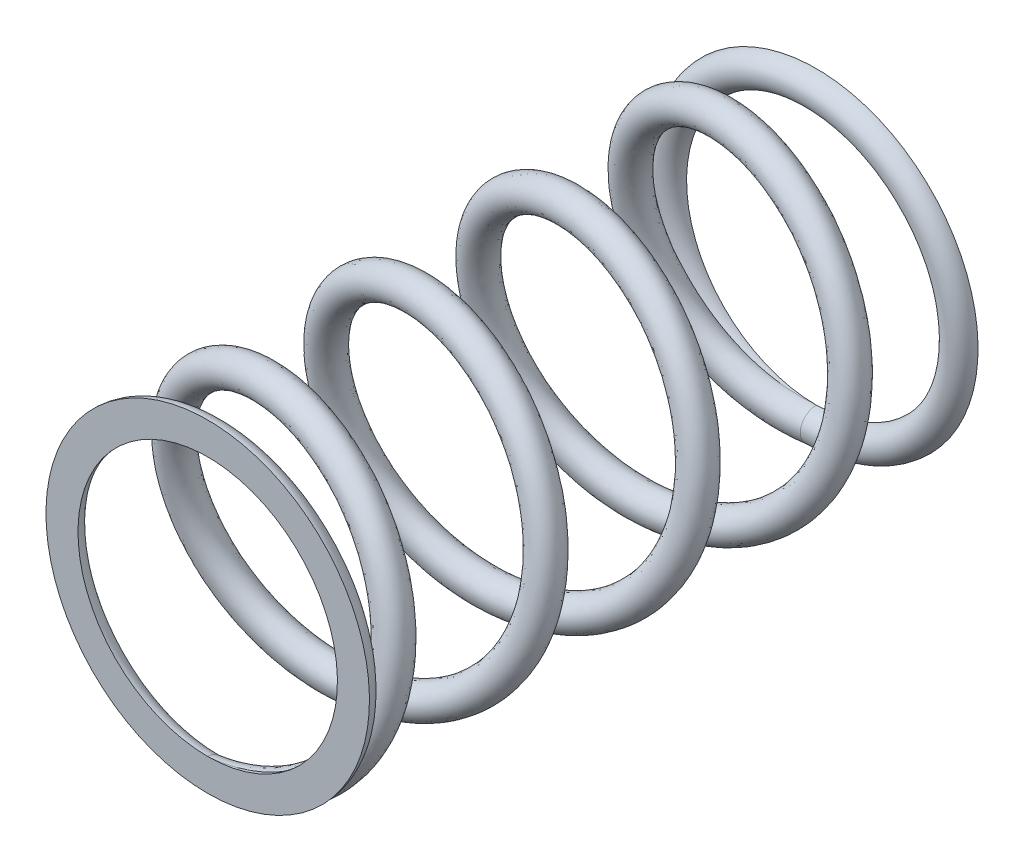
from build123d import *
from build123d.topology import SkipClean

# Parameters (mm, degrees)
SWEEP1_PITCH                  = 4.75
SWEEP1_HEIGHT                 = 19
SWEEP1_RADIUS                 = 4.55
SWEEP1_START_ANGLE            = -90
SCHIZZO19_R                   = 0.5
SCHIZZO17_R                   = 0.5
SCHIZZO18_R                   = 0.5
TAGLIO_ESTRUSIONE1_DEPTH      = 21.766680185
TAGLIO_ESTRUSIONE1_DEPTH_BACK = 21.766680185
SCHIZZO23_W                   = 10.1
SCHIZZO23_H                   = 0.5


with BuildPart() as part:
    # Sweep1: sweep along a helix
    with BuildLine() as sweep1_path:
        add(Helix(SWEEP1_PITCH, SWEEP1_HEIGHT, SWEEP1_RADIUS, center=(0, 0, 0), direction=(0, 0, 1), lefthand=True, mode=Mode.PRIVATE).rotate(Axis((0, 0, 0), (0, 0, 1)), SWEEP1_START_ANGLE))
    # Schizzo19 → Sweep1 (sweep)
    with BuildSketch(Plane(origin=(0, 0, 0), x_dir=(0, 0, -1), z_dir=(1, 0, 0))):
        with Locations((0, -4.55)):
            Circle(SCHIZZO19_R)
    sweep(path=sweep1_path.line, is_frenet=True)

    # Schizzo17 → Rivoluzione3 (revolve)
    with SkipClean():  # the faces are left unmerged after this step: merging them gives an invalid solid
        with BuildSketch(Plane.ZY, mode=Mode.PRIVATE) as rivoluzione3_sk:
            with Locations((19, -4.55)):
                Circle(SCHIZZO17_R)
        revolve(rivoluzione3_sk.sketch.rotate(Axis((0, 0, -1000), (0, 0, 1)), 270), axis=Axis((0, 0, -1000), (0, 0, 1)))

    # Schizzo18 → Rivoluzione4 (revolve)
    with SkipClean():  # the faces are left unmerged after this step: merging them gives an invalid solid
        with BuildSketch(Plane(origin=(0, 0, 0), x_dir=(0, 0, -1), z_dir=(1, 0, 0)), mode=Mode.PRIVATE) as rivoluzione4_sk:
            with Locations((0, -4.55)):
                Circle(SCHIZZO18_R)
        revolve(rivoluzione4_sk.sketch.rotate(Axis((0, 0, 1000), (0, 0, -1)), 270), axis=Axis((0, 0, 1000), (0, 0, -1)))

    # Schizzo23 → Taglio-Estrusione1 (cut, two sides: drawn at the far end of the back side and taken through both)
    with BuildSketch(Plane(origin=(0, 0, 0), x_dir=(1, 0, 0), z_dir=(0, 1, 0)).offset(-TAGLIO_ESTRUSIONE1_DEPTH_BACK)):
        with Locations((0, 0.25)):
            Rectangle(SCHIZZO23_W, SCHIZZO23_H)
        with Locations((0, -19.25)):
            Rectangle(SCHIZZO23_W, SCHIZZO23_H)
    extrude(amount=TAGLIO_ESTRUSIONE1_DEPTH + TAGLIO_ESTRUSIONE1_DEPTH_BACK, mode=Mode.SUBTRACT)


solid = part.part
